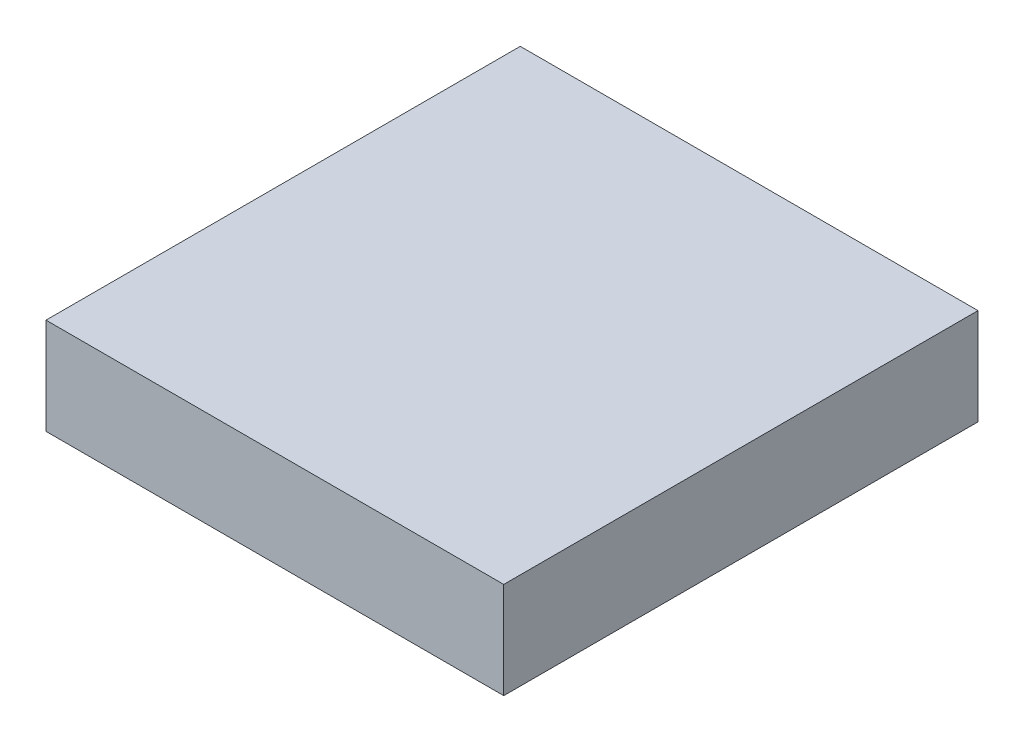
from build123d import *

# Parameters (mm, degrees)
SKETCH1_W               = 0.9652
SKETCH1_H               = 0.2032
COMPONENT_OUTLINE_DEPTH = 1


with BuildPart() as part:
    # Sketch1 → Component_Outline (new body)
    with BuildSketch(Plane.XY):
        Rectangle(SKETCH1_W, SKETCH1_H)
    extrude(amount=COMPONENT_OUTLINE_DEPTH)


solid = part.part
